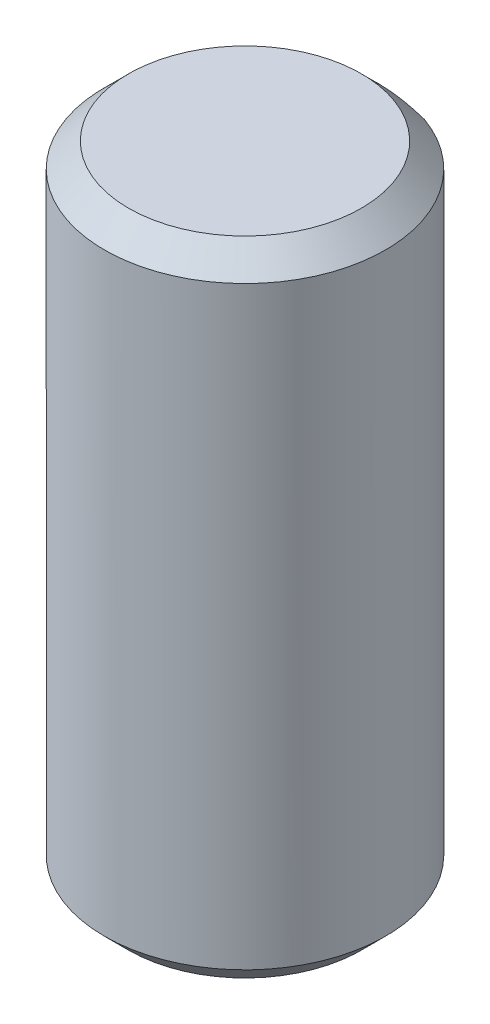
from build123d import *

# Parameters (mm, degrees)
SKETCH1_R               = 17.5
BOSS_EXTRUDE1_DEPTH     = 80
CHAMFER1_SIZE           = 3
CUT_EXTRUDE1_DEPTH      = 84.740671122
CUT_EXTRUDE1_DEPTH_BACK = 84.740671122
SKETCH2_W               = 35
SKETCH2_H               = 5


with BuildPart() as part:
    # Sketch1 → Boss-Extrude1 (new body)
    with BuildSketch(Plane(origin=(0, 0, 0), x_dir=(1, 0, 0), z_dir=(0, 1, 0))):
        with Locations(Location((0, 0, 0), (0, 0, 270))):
            Circle(SKETCH1_R)
    extrude(amount=BOSS_EXTRUDE1_DEPTH)

    # Chamfer1
    chamfer1_edges = [part.edges().sort_by_distance(p)[0] for p in [
        (0, 0, -17.5),
        (0, 80, -17.5),
    ]]
    chamfer(chamfer1_edges, length=CHAMFER1_SIZE)

    # Sketch2 → Cut-Extrude1 (cut, two sides: drawn at the far end of the back side and taken through both)
    with BuildSketch(Plane(origin=(0, 0, 0), x_dir=(1, 0, 0), z_dir=(0, 1, 0)).offset(-CUT_EXTRUDE1_DEPTH_BACK)):
        with Locations((0, 19)):
            Rectangle(SKETCH2_W, SKETCH2_H)
    extrude(amount=CUT_EXTRUDE1_DEPTH + CUT_EXTRUDE1_DEPTH_BACK, mode=Mode.SUBTRACT)


solid = part.part
